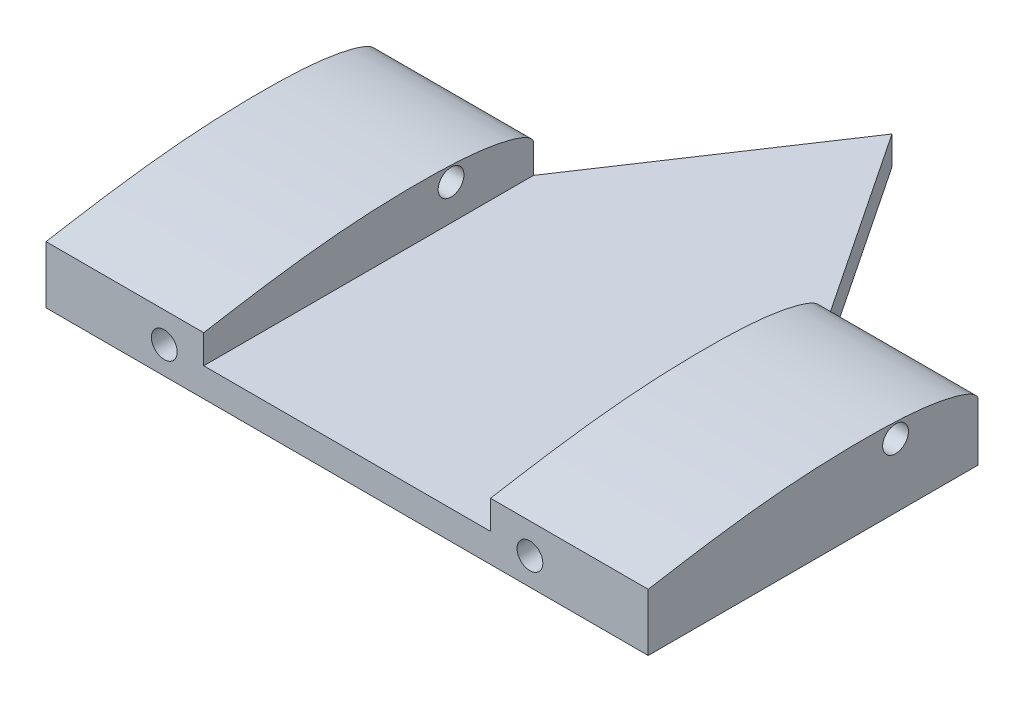
from build123d import *

# Parameters (mm, degrees)
ESTRUSIONE_ESTRUSIONE1_DEPTH  = 10
SCHIZZO4_W                    = 110
SCHIZZO4_H                    = 230
ESTRUSIONE_ESTRUSIONE2_DEPTH  = 30
ESTRUSIONE_ESTRUSIONE6_DEPTH  = 110
ESTRUSIONE_ESTRUSIONE7_DEPTH  = 110
TAGLIO_ESTRUSIONE1_DEPTH      = 411.357133016
TAGLIO_ESTRUSIONE1_DEPTH_BACK = 411.357133016
SCHIZZO12_R                   = 9
ESTRUSIONE_ESTRUSIONE8_DEPTH  = 10
SCHIZZO13_R                   = 9
TAGLIO_ESTRUSIONE2_DEPTH      = 210
TAGLIO_ESTRUSIONE3_START      = -20
SCHIZZO13_3_R                 = 9
TAGLIO_ESTRUSIONE3_DEPTH      = 210


with BuildPart() as part:
    # Schizzo3 → Estrusione-Estrusione1 (new body)
    with BuildSketch(Plane(origin=(0, 0, 0), x_dir=(1, 0, 0), z_dir=(0, 1, 0))):
        Polygon((-100, 115), (0, 265), (100, 115), (100, -115), (-100, -115), align=None)
    extrude(amount=ESTRUSIONE_ESTRUSIONE1_DEPTH)

    # Schizzo4 → Estrusione-Estrusione2 (add)
    with BuildSketch(Plane(origin=(0, 0, 0), x_dir=(1, 0, 0), z_dir=(0, 1, 0))):
        with Locations((-155, 0)):
            Rectangle(SCHIZZO4_W, SCHIZZO4_H)
    estrusione_estrusione2 = extrude(amount=ESTRUSIONE_ESTRUSIONE2_DEPTH)

    # Specchia1: Estrusione-Estrusione2 across plane
    add(estrusione_estrusione2.mirror(Plane(origin=(0, 0, 0), x_dir=(0, 0, 1), z_dir=(1, 0, 0))))

    # Schizzo7 → Estrusione-Estrusione6 (add)
    with BuildSketch(Plane(origin=(210, 0, 0), x_dir=(0, 0, -1), z_dir=(1, 0, 0))):
        Polygon((-115, 30), (-67.116126168, 36.704444838), (-28.045596082, 30), align=None)
    estrusione_estrusione6 = extrude(amount=-ESTRUSIONE_ESTRUSIONE6_DEPTH)

    # Schizzo2 → Estrusione-Estrusione7 (add)
    with BuildSketch(Plane(origin=(100, 0, 0), x_dir=(0, 0, -1), z_dir=(1, 0, 0))):
        with BuildLine():
            add(Edge.make_bspline(
                [(-115, 30), (-115.000210545, 29.992600645), (-113.422148564, 30.158475864), (-111.796644727, 30.283772029), (-107.814194843, 30.630338356), (-102.861879623, 30.987329262), (-96.305865405, 31.376231826), (-88.489318037, 31.675517587), (-79.430494503, 31.807742684), (-69.341391082, 31.683388701), (-58.419850102, 31.274503076), (-46.877369477, 30.644796944), (-34.896947284, 29.847039434), (-22.646613535, 28.937405028), (-10.282420858, 27.977069897), (2.053986621, 27.029846245), (14.24124297, 26.170492863), (26.177229823, 25.446707781), (37.774042318, 24.895496731), (48.941874013, 24.516768377), (59.573909852, 24.266890816), (69.552699105, 24.140231832), (78.754080602, 24.115655421), (87.066553377, 24.222109148), (94.380340607, 24.454254196), (100.623442659, 24.835372596), (105.733457905, 25.450246293), (109.757791111, 26.267165094), (112.584447535, 27.347686718), (114.544522218, 28.409436669), (115.019506308, 29.606391564), (114.971300063, 30.713259492), (114.252481427, 32.105291566), (112.489642477, 33.883468186), (109.692003391, 35.61309624), (105.909966736, 37.265146946), (101.131610144, 38.854984679), (95.405801052, 40.36655429), (88.783353126, 41.751140678), (81.322054125, 42.956355889), (73.073722079, 43.933595569), (64.094685163, 44.671576526), (54.449786097, 45.162759351), (44.224155903, 45.437556505), (33.519437101, 45.505243934), (22.451785091, 45.379017652), (11.14328681, 45.063940096), (-0.28571179, 44.551548305), (-11.723358771, 43.840961212), (-23.065724405, 42.92819664), (-34.215267516, 41.845440169), (-45.069232514, 40.620473007), (-55.523547672, 39.302812034), (-65.469499205, 37.938342947), (-74.795963084, 36.558195732), (-83.315166316, 35.270519644), (-91.058717697, 33.948165881), (-97.854142359, 32.926071265), (-103.726595065, 31.930242691), (-108.212226347, 31.145720718), (-111.912932633, 30.508420978), (-113.462111319, 30.226412439), (-114.999791168, 30.00733917), (-115, 30)],
                knots=[0, 0, 0, 0, 0.001588889, 0.006329218, 0.014202456, 0.025172808, 0.039173483, 0.056060631, 0.075578924, 0.097363607, 0.120926258, 0.145825281, 0.171670912, 0.198108537, 0.224790184, 0.25139058, 0.277643491, 0.30332675, 0.328257458, 0.352272548, 0.375156062, 0.396620664, 0.416422729, 0.43430442, 0.45005468, 0.463465465, 0.474478994, 0.483169222, 0.489678354, 0.494104066, 0.496910015, 0.497289785, 0.501214273, 0.50645795, 0.513356957, 0.522168632, 0.53296597, 0.545689209, 0.560220779, 0.576438923, 0.594258689, 0.613600245, 0.634342386, 0.656331109, 0.679351894, 0.703152303, 0.727478208, 0.752070739, 0.776691164, 0.801140184, 0.825214387, 0.848697424, 0.871352858, 0.892947449, 0.913230871, 0.931955467, 0.948342069, 0.963693004, 0.976235918, 0.986320059, 0.993788799, 0.998424035, 1, 1, 1, 1], degree=3))
        make_face()
    estrusione_estrusione7 = extrude(amount=ESTRUSIONE_ESTRUSIONE7_DEPTH)

    # Specchia2: Estrusione-Estrusione6, Estrusione-Estrusione7 across plane
    add(estrusione_estrusione6.mirror(Plane(origin=(0, 0, 0), x_dir=(0, 0, 1), z_dir=(1, 0, 0))))
    add(estrusione_estrusione7.mirror(Plane(origin=(0, 0, 0), x_dir=(0, 0, 1), z_dir=(1, 0, 0))))

    # Schizzo12 → Taglio-Estrusione1 (cut, two sides: drawn at the far end of the back side and taken through both)
    with BuildSketch(Plane(origin=(100, 0, 0), x_dir=(0, 0, -1), z_dir=(1, 0, 0)).offset(-TAGLIO_ESTRUSIONE1_DEPTH_BACK)):
        with Locations((57.5, 34.659164248)):
            Circle(SCHIZZO12_R)
    extrude(amount=TAGLIO_ESTRUSIONE1_DEPTH + TAGLIO_ESTRUSIONE1_DEPTH_BACK, mode=Mode.SUBTRACT)

    # Schizzo14 → Estrusione-Estrusione8 (add)
    with BuildSketch(Plane.XZ):
        Polygon((-210, 115), (210, 115), (210, -115), (100, -115), (0, -265), (-100, -115), (-210, -115), align=None)
    extrude(amount=ESTRUSIONE_ESTRUSIONE8_DEPTH)

    # Schizzo13 → Taglio-Estrusione2 (cut)
    with BuildSketch(Plane.XY.offset(115)):
        with Locations((-127.5, 9)):
            Circle(SCHIZZO13_R)
    taglio_estrusione2 = extrude(amount=-TAGLIO_ESTRUSIONE2_DEPTH, mode=Mode.SUBTRACT)

    # Schizzo13<3> → Taglio-Estrusione3 (cut)
    with BuildSketch(Plane.XY.offset(115).offset(TAGLIO_ESTRUSIONE3_START)):
        with Locations((-182.5, 9)):
            Circle(SCHIZZO13_3_R)
    taglio_estrusione3 = extrude(amount=-TAGLIO_ESTRUSIONE3_DEPTH, mode=Mode.SUBTRACT)

    # Specchia3: Taglio-Estrusione2, Taglio-Estrusione3 across plane
    add(taglio_estrusione2.mirror(Plane(origin=(0, 0, 0), x_dir=(0, 0, 1), z_dir=(1, 0, 0))), mode=Mode.SUBTRACT)
    add(taglio_estrusione3.mirror(Plane(origin=(0, 0, 0), x_dir=(0, 0, 1), z_dir=(1, 0, 0))), mode=Mode.SUBTRACT)


solid = part.part
